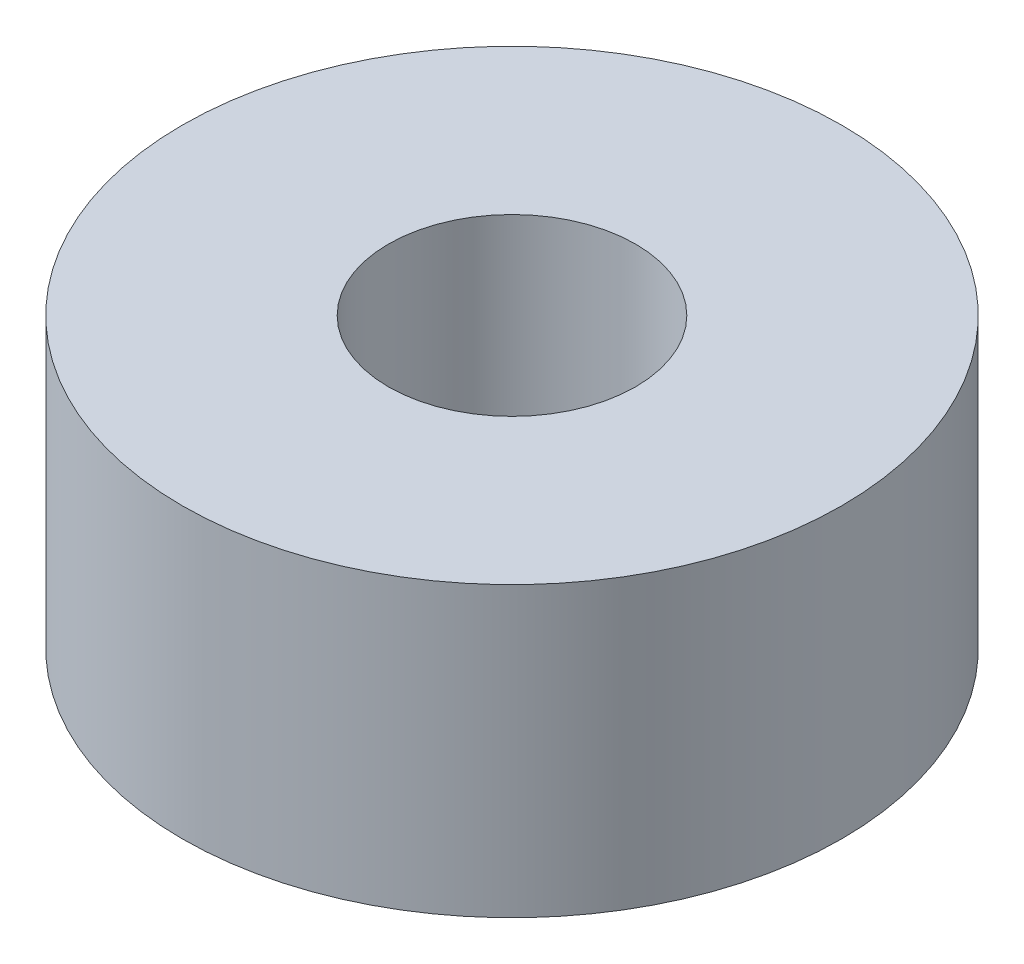
from build123d import *

# Parameters (mm, degrees)
SKETCH_1_R      = 4
SKETCH_1_R_2    = 1.5
EXTRUDE_1_DEPTH = 3.5


with BuildPart() as part:
    # 草图1 → 凸台-拉伸1 (new body)
    with BuildSketch(Plane(origin=(0, 0, 0), x_dir=(1, 0, 0), z_dir=(0, 1, 0))):
        with Locations(Location((0, 0, 0), (0, 0, 270))):
            Circle(SKETCH_1_R)
        with Locations(Location((0, 0, 0), (0, 0, 270))):
            Circle(SKETCH_1_R_2, mode=Mode.SUBTRACT)
    extrude(amount=EXTRUDE_1_DEPTH)


solid = part.part
